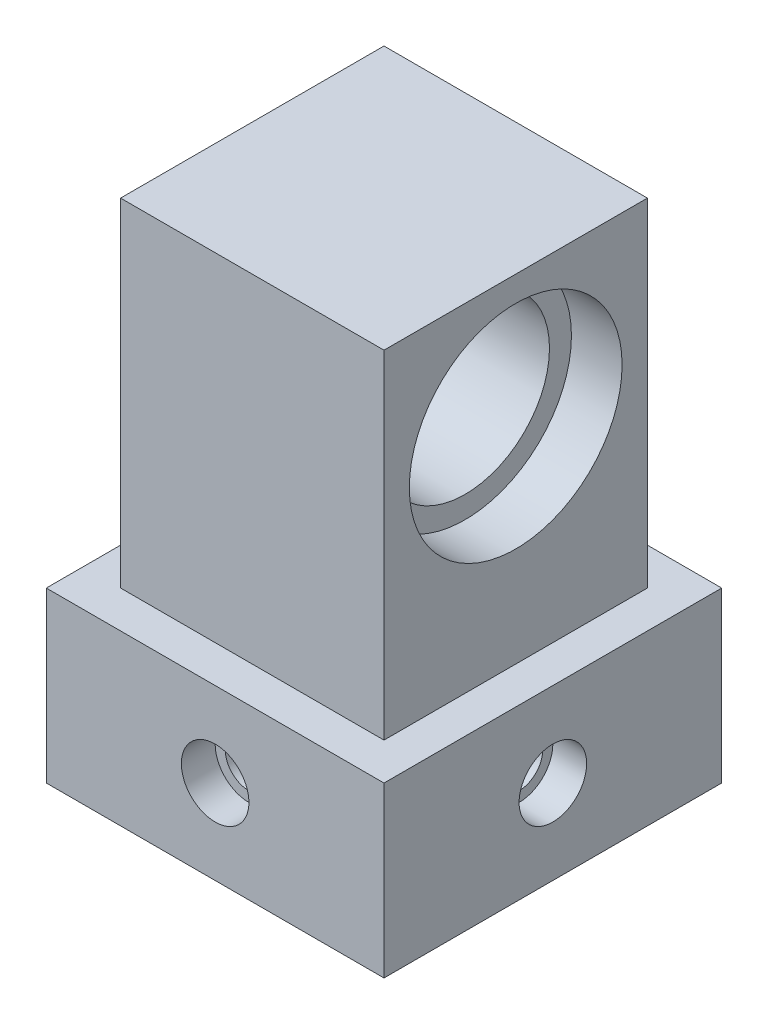
from build123d import *

# Parameters (mm, degrees)
SKETCH_1_W           = 10
SKETCH_1_H           = 10
SKETCH_1_W_2         = 6.2
SKETCH_1_H_2         = 6.2
EXTRUDE_1_DEPTH      = 4
SKETCH_1_R           = 1.25
EXTRUDE_1_2_DEPTH    = 4
EXTRUDE_START        = 4
SKETCH_1_3_W         = 10
SKETCH_1_3_H         = 10
EXTRUDE_2_DEPTH      = 1
SKETCH_2_W           = 7.8
SKETCH_2_H           = 7.8
EXTRUDE_3_DEPTH      = 10
SKETCH_3_R           = 2.5
CUT_EXTRUDE_1_DEPTH  = 19.144145061
SKETCH_3_3_R         = 3.15
SKETCH_3_3_R_2       = 2.5
CUT_EXTRUDE_2_DEPTH  = 1.5
CUT_EXTRUDE_START    = -6.3
SKETCH_3_4_R         = 3.15
SKETCH_3_4_R_2       = 2.5
CUT_EXTRUDE_3_DEPTH  = 1.5
SKETCH_4_R           = 1
SKETCH_4_R_2         = 0.7
CUT_EXTRUDE_4_DEPTH  = 1
CUT_EXTRUDE_START_2  = -9
SKETCH_4_2_R         = 1
SKETCH_4_2_R_2       = 0.7
CUT_EXTRUDE_5_DEPTH  = 1
CUT_EXTRUDE_6_REACH  = 20.708
SKETCH_4_3_R         = 0.7
CUT_EXTRUDE_START_3  = -10
SKETCH_4_4_R         = 0.7
CUT_EXTRUDE_7_DEPTH  = 1.9
CUT_EXTRUDE_8_REACH  = 20.708
SKETCH_5_R           = 0.7
SKETCH_5_3_R         = 0.7
CUT_EXTRUDE_9_DEPTH  = 1.9
SKETCH_5_4_R         = 1
CUT_EXTRUDE_10_DEPTH = 1
SKETCH_5_5_R         = 1
CUT_EXTRUDE_11_DEPTH = 1


with BuildPart() as part:
    # 草图1 → 凸台-拉伸1 (new body)
    with BuildSketch(Plane(origin=(0, 0, 0), x_dir=(1, 0, 0), z_dir=(0, 1, 0))):
        Rectangle(SKETCH_1_W, SKETCH_1_H)
        Rectangle(SKETCH_1_W_2, SKETCH_1_H_2, mode=Mode.SUBTRACT)
    extrude(amount=EXTRUDE_1_DEPTH)



with BuildPart() as body_2:
    # 草图1 → Extrude 1 2 (new body)
    with BuildSketch(Plane(origin=(0, 0, 0), x_dir=(1, 0, 0), z_dir=(0, 1, 0))):
        with Locations(Location((0, 0, 0), (0, 0, 270))):
            Circle(SKETCH_1_R)
    extrude(amount=EXTRUDE_1_2_DEPTH)


with BuildPart() as part_1:
    add(part.part)

    add(body_2.part)  # 凸台-拉伸2 merges body 2
    # 草图1<3> → 凸台-拉伸2 (add)
    with BuildSketch(Plane(origin=(0, 0, 0), x_dir=(1, 0, 0), z_dir=(0, 1, 0)).offset(EXTRUDE_START)):
        Rectangle(SKETCH_1_3_W, SKETCH_1_3_H)
    extrude(amount=EXTRUDE_2_DEPTH)

    # 草图2 → 凸台-拉伸3 (add)
    with BuildSketch(Plane(origin=(0, 5, 0), x_dir=(1, 0, 0), z_dir=(0, 1, 0))):
        Rectangle(SKETCH_2_W, SKETCH_2_H)
    extrude(amount=EXTRUDE_3_DEPTH)

    # 草图3 → 切除-拉伸1 (cut, through all)
    with BuildSketch(Plane(origin=(3.9, 0, 0), x_dir=(0, 0, -1), z_dir=(1, 0, 0))):
        with Locations((0, 11.1)):
            Circle(SKETCH_3_R)
    extrude(amount=-CUT_EXTRUDE_1_DEPTH, mode=Mode.SUBTRACT)

    # 草图3<3> → 切除-拉伸2 (cut)
    with BuildSketch(Plane(origin=(3.9, 0, 0), x_dir=(0, 0, -1), z_dir=(1, 0, 0))):
        with Locations((0, 11.1)):
            Circle(SKETCH_3_3_R)
        with Locations((0, 11.1)):
            Circle(SKETCH_3_3_R_2, mode=Mode.SUBTRACT)
    extrude(amount=-CUT_EXTRUDE_2_DEPTH, mode=Mode.SUBTRACT)

    # 草图3<4> → 切除-拉伸3 (cut)
    with BuildSketch(Plane(origin=(3.9, 0, 0), x_dir=(0, 0, -1), z_dir=(1, 0, 0)).offset(CUT_EXTRUDE_START)):
        with Locations((0, 11.1)):
            Circle(SKETCH_3_4_R)
        with Locations((0, 11.1)):
            Circle(SKETCH_3_4_R_2, mode=Mode.SUBTRACT)
    extrude(amount=-CUT_EXTRUDE_3_DEPTH, mode=Mode.SUBTRACT)

    # 草图4 → 切除-拉伸4 (cut)
    with BuildSketch(Plane(origin=(5, 0, 0), x_dir=(0, 0, -1), z_dir=(1, 0, 0))):
        with Locations((0, 2.5)):
            Circle(SKETCH_4_R)
        with Locations((0, 2.5)):
            Circle(SKETCH_4_R_2, mode=Mode.SUBTRACT)
    extrude(amount=-CUT_EXTRUDE_4_DEPTH, mode=Mode.SUBTRACT)

    # 草图4<2> → 切除-拉伸5 (cut)
    with BuildSketch(Plane(origin=(5, 0, 0), x_dir=(0, 0, -1), z_dir=(1, 0, 0)).offset(CUT_EXTRUDE_START_2)):
        with Locations((0, 2.5)):
            Circle(SKETCH_4_2_R)
        with Locations((0, 2.5)):
            Circle(SKETCH_4_2_R_2, mode=Mode.SUBTRACT)
    extrude(amount=-CUT_EXTRUDE_5_DEPTH, mode=Mode.SUBTRACT)

    # 草图4<3> → 切除-拉伸6 (cut, up to next)
    with BuildSketch(Plane(origin=(5, 0, 0), x_dir=(0, 0, -1), z_dir=(1, 0, 0)), mode=Mode.PRIVATE) as cut_extrude_6_sk1:
        with Locations(Location((0, 2.5, 0), (0, 0, 180))):
            Circle(SKETCH_4_3_R)
    cut_extrude_6_tool1 = extrude(cut_extrude_6_sk1.sketch, amount=-CUT_EXTRUDE_6_REACH, mode=Mode.PRIVATE) & part_1.part
    add(cut_extrude_6_tool1.solids().sort_by_distance((5, 2.5, 0))[0], mode=Mode.SUBTRACT)

    # 草图4<4> → 切除-拉伸7 (cut)
    with BuildSketch(Plane(origin=(5, 0, 0), x_dir=(0, 0, -1), z_dir=(1, 0, 0)).offset(CUT_EXTRUDE_START_3)):
        with Locations((0, 2.5)):
            Circle(SKETCH_4_4_R)
    extrude(amount=CUT_EXTRUDE_7_DEPTH, mode=Mode.SUBTRACT)

    # 草图5 → 切除-拉伸8 (cut, up to next)
    with BuildSketch(Plane(origin=(0, 0, -5), x_dir=(-1, 0, 0), z_dir=(0, 0, -1)), mode=Mode.PRIVATE) as cut_extrude_8_sk1:
        with Locations((0, 2.5)):
            Circle(SKETCH_5_R)
    cut_extrude_8_tool1 = extrude(cut_extrude_8_sk1.sketch, amount=-CUT_EXTRUDE_8_REACH, mode=Mode.PRIVATE) & part_1.part
    add(cut_extrude_8_tool1.solids().sort_by_distance((0, 2.5, -5))[0], mode=Mode.SUBTRACT)

    # 草图5<3> → 切除-拉伸9 (cut)
    with BuildSketch(Plane(origin=(0, 0, -5), x_dir=(-1, 0, 0), z_dir=(0, 0, -1)).offset(CUT_EXTRUDE_START_3)):
        with Locations((0, 2.5)):
            Circle(SKETCH_5_3_R)
    extrude(amount=CUT_EXTRUDE_9_DEPTH, mode=Mode.SUBTRACT)

    # 草图5<4> → 切除-拉伸10 (cut)
    with BuildSketch(Plane(origin=(0, 0, -5), x_dir=(-1, 0, 0), z_dir=(0, 0, -1))):
        with Locations((0, 2.5)):
            Circle(SKETCH_5_4_R)
    extrude(amount=-CUT_EXTRUDE_10_DEPTH, mode=Mode.SUBTRACT)

    # 草图5<5> → 切除-拉伸11 (cut)
    with BuildSketch(Plane(origin=(0, 0, -5), x_dir=(-1, 0, 0), z_dir=(0, 0, -1)).offset(CUT_EXTRUDE_START_2)):
        with Locations((0, 2.5)):
            Circle(SKETCH_5_5_R)
    extrude(amount=-CUT_EXTRUDE_11_DEPTH, mode=Mode.SUBTRACT)


solid = part_1.part
